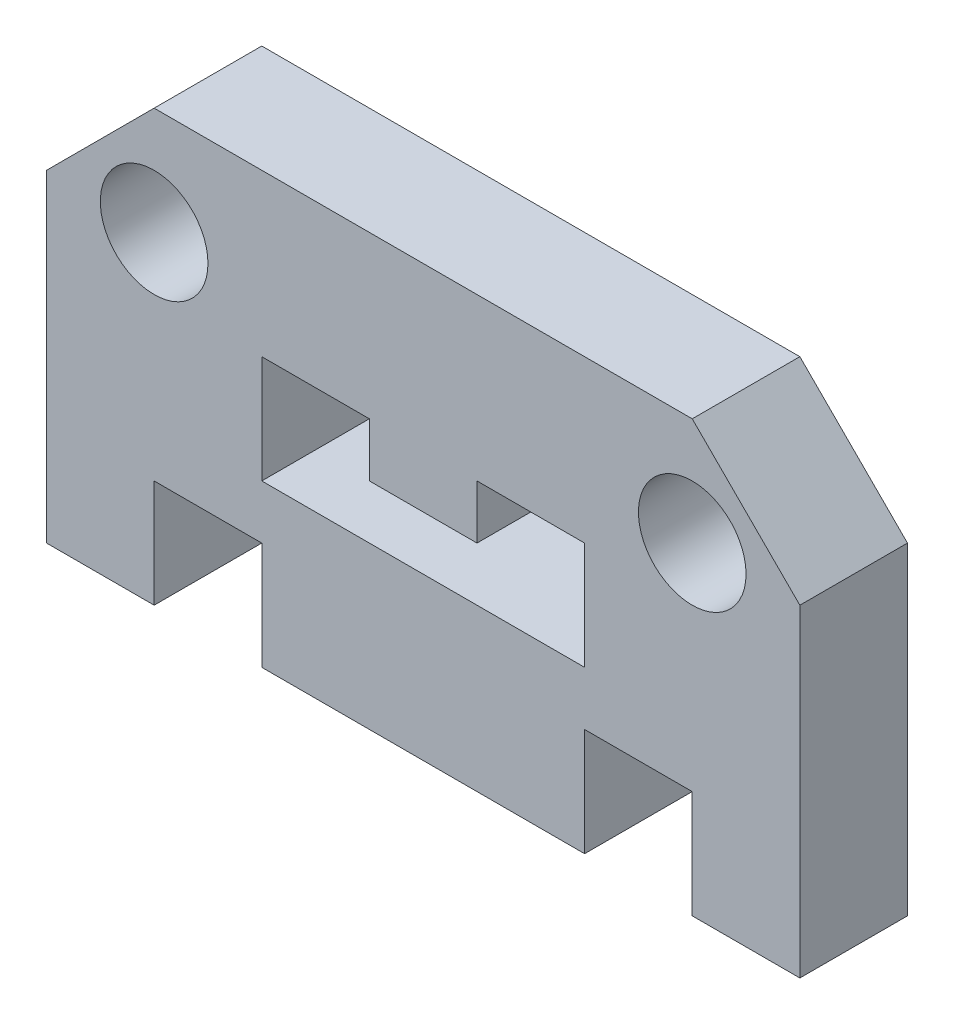
from build123d import *

# Parameters (mm, degrees)
SKETCH1_R           = 5
BOSS_EXTRUDE1_DEPTH = 10


with BuildPart() as part:
    # Sketch1 → Boss-Extrude1 (new body)
    with BuildSketch(Plane.XY):
        Polygon((-35, 30), (-25, 40), (25, 40), (35, 30), (35, 0), (25, 0), (25, 10), (15, 10), (15, 0), (-15, 0), (-15, 10), (-25, 10), (-25, 0), (-35, 0), align=None)
        with Locations((-25, 30)):
            Circle(SKETCH1_R, mode=Mode.SUBTRACT)
        with Locations((25, 30)):
            Circle(SKETCH1_R, mode=Mode.SUBTRACT)
        Polygon((15, 15), (-15, 15), (-15, 25), (-5, 25), (-5, 20), (5, 20), (5, 25), (15, 25), align=None, mode=Mode.SUBTRACT)
    extrude(amount=BOSS_EXTRUDE1_DEPTH)


solid = part.part
